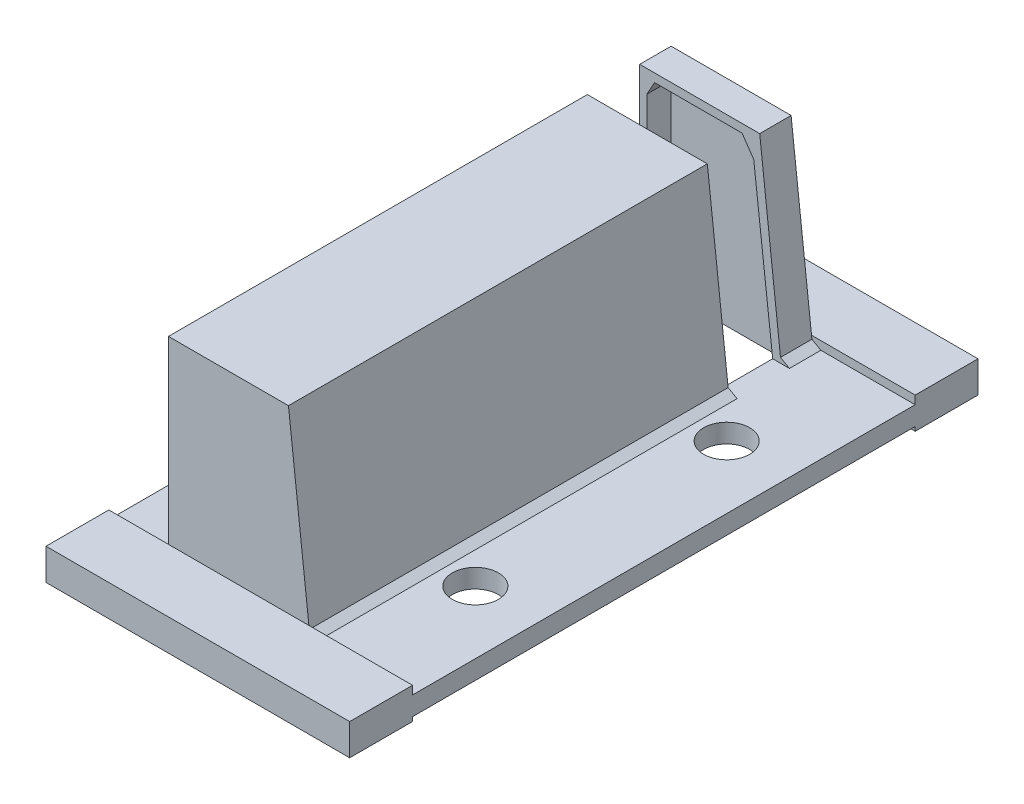
from build123d import *

# Parameters (mm, degrees)
BOSS_EXTRUDE2_DEPTH   = 3.81
BOSS_EXTRUDE2_2_DEPTH = 3.81
BOSS_EXTRUDE3_START   = 0.508
SKETCH2_3_R           = 2.794
BOSS_EXTRUDE3_DEPTH   = 2.286
BOSS_EXTRUDE11_DEPTH  = 3.81
BOSS_EXTRUDE12_DEPTH  = 0.889
BOSS_EXTRUDE14_START  = 10.16
BOSS_EXTRUDE14_DEPTH  = 50.8
BOSS_EXTRUDE17_START  = 60.071
BOSS_EXTRUDE17_DEPTH  = 0.889
SKETCH14_W            = 15.24
SKETCH14_H            = 59.182
CUT_EXTRUDE3_DEPTH    = 88.666803866


with BuildPart() as part:
    # Sketch2 → Boss-Extrude2 (new body)
    with BuildSketch(Plane(origin=(0, 0, 0), x_dir=(1, 0, 0), z_dir=(0, 1, 0))):
        Polygon((0, 7.62), (0, 0), (36.83, 0), (36.83, 7.62), (7.62, 7.62), (6.87, 7.62), align=None)
    extrude(amount=BOSS_EXTRUDE2_DEPTH)



with BuildPart() as body_2:
    # Sketch2 → Boss-Extrude2 2 (new body)
    with BuildSketch(Plane(origin=(0, 0, 0), x_dir=(1, 0, 0), z_dir=(0, 1, 0))):
        Polygon((0, 76.2), (0, 68.58), (6.87, 68.58), (7.62, 68.58), (36.83, 68.58), (36.83, 76.2), align=None)
    extrude(amount=BOSS_EXTRUDE2_2_DEPTH)


with BuildPart() as part_1:
    add(part.part)

    add(body_2.part)  # Boss-Extrude3 merges body 2
    # Sketch2<3> → Boss-Extrude3 (add)
    # profile 1 of 2: a face of its own
    with BuildSketch(Plane(origin=(0, 0, 0), x_dir=(1, 0, 0), z_dir=(0, 1, 0)).offset(BOSS_EXTRUDE3_START)):
        Polygon((0, 68.58), (0, 7.62), (6.87, 7.62), (7.62, 7.62), (36.83, 7.62), (36.83, 68.58), (7.62, 68.58), (6.87, 68.58), align=None)
        with Locations(Location((29.21, 22.86, 0), (0, 0, 270))):
            Circle(SKETCH2_3_R, mode=Mode.SUBTRACT)
        with Locations(Location((29.21, 53.34, 0), (0, 0, 270))):
            Circle(SKETCH2_3_R, mode=Mode.SUBTRACT)
    # profile 2 of 2: a face of its own
    with BuildSketch(Plane(origin=(0, 0, 0), x_dir=(1, 0, 0), z_dir=(0, 1, 0)).offset(BOSS_EXTRUDE3_START)):
        Polygon((0, 68.58), (0, 7.62), (6.87, 7.62), (7.62, 7.62), (36.83, 7.62), (36.83, 68.58), (7.62, 68.58), (6.87, 68.58), align=None)
        with Locations(Location((29.21, 22.86, 0), (0, 0, 270))):
            Circle(SKETCH2_3_R, mode=Mode.SUBTRACT)
        with Locations(Location((29.21, 53.34, 0), (0, 0, 270))):
            Circle(SKETCH2_3_R, mode=Mode.SUBTRACT)
    extrude(amount=BOSS_EXTRUDE3_DEPTH)

    # Sketch13 → Boss-Extrude11 (add)
    with BuildSketch(Plane.XY.offset(-68.58)):
        Polygon((6.215980089, 2.794), (7.231980089, 2.794), (7.231980089, 3.298518966), align=None)
        Polygon((8.120980089, 2.794), (8.120980089, 3.81), (7.231980089, 3.81), (7.231980089, 3.298518966), (7.231980089, 2.794), align=None)
        Polygon((8.120980089, 3.81), (8.120980089, 22.975432281), (8.120980089, 24.638), (9.046534916, 24.638), (19.649280137, 24.638), (20.820980089, 24.638), (21.060045846, 22.582034491), (23.242840554, 3.81), (24.261745737, 3.81), (21.784207173, 25.654), (7.231980089, 25.654), (7.231980089, 3.81), align=None)
        Polygon((8.120980089, 24.638), (8.120980089, 22.975432281), (9.046534916, 24.638), align=None)
        Polygon((20.820980089, 24.638), (19.649280137, 24.638), (21.060045846, 22.582034491), align=None)
        Polygon((24.261745737, 3.81), (23.242840554, 3.81), (23.360980089, 2.794), (24.376980089, 2.794), (24.307041878, 3.410632288), align=None)
        Polygon((24.307041878, 3.410632288), (24.376980089, 2.794), (25.392980089, 2.794), align=None)
    extrude(amount=BOSS_EXTRUDE11_DEPTH)

    # Sketch13<3> → Boss-Extrude12 (add)
    with BuildSketch(Plane.XY.offset(-68.58)):
        Polygon((9.046534916, 24.638), (8.120980089, 22.975432281), (8.120980089, 3.81), (23.242840554, 3.81), (21.060045846, 22.582034491), (19.649280137, 24.638), align=None)
        Polygon((23.242840554, 3.81), (8.120980089, 3.81), (8.120980089, 2.794), (23.360980089, 2.794), align=None)
    extrude(amount=BOSS_EXTRUDE12_DEPTH)

    # Sketch13<6> → Boss-Extrude14 (add)
    with BuildSketch(Plane.XY.offset(-68.58).offset(BOSS_EXTRUDE14_START)):
        Polygon((24.307041878, 3.410632288), (24.376980089, 2.794), (25.392980089, 2.794), align=None)
        Polygon((24.261745737, 3.81), (23.242840554, 3.81), (23.360980089, 2.794), (24.376980089, 2.794), (24.307041878, 3.410632288), align=None)
        Polygon((8.120980089, 2.794), (8.120980089, 3.81), (7.231980089, 3.81), (7.231980089, 3.298518966), (7.231980089, 2.794), align=None)
        Polygon((6.215980089, 2.794), (7.231980089, 2.794), (7.231980089, 3.298518966), align=None)
        Polygon((8.120980089, 3.81), (8.120980089, 22.975432281), (8.120980089, 24.638), (9.046534916, 24.638), (19.649280137, 24.638), (20.820980089, 24.638), (21.060045846, 22.582034491), (23.242840554, 3.81), (24.261745737, 3.81), (21.784207173, 25.654), (7.231980089, 25.654), (7.231980089, 3.81), align=None)
        Polygon((20.820980089, 24.638), (19.649280137, 24.638), (21.060045846, 22.582034491), align=None)
        Polygon((8.120980089, 24.638), (8.120980089, 22.975432281), (9.046534916, 24.638), align=None)
    extrude(amount=BOSS_EXTRUDE14_DEPTH)

    # Sketch13<7> → Boss-Extrude17 (add)
    with BuildSketch(Plane.XY.offset(-68.58).offset(BOSS_EXTRUDE17_START)):
        Polygon((9.046534916, 24.638), (8.120980089, 22.975432281), (8.120980089, 3.81), (23.242840554, 3.81), (21.060045846, 22.582034491), (19.649280137, 24.638), align=None)
        Polygon((23.242840554, 3.81), (8.120980089, 3.81), (8.120980089, 2.794), (23.360980089, 2.794), align=None)
    extrude(amount=BOSS_EXTRUDE17_DEPTH)

    # Sketch14 → Cut-Extrude3 (cut, through all)
    with BuildSketch(Plane(origin=(0, 2.794, 0), x_dir=(1, 0, 0), z_dir=(0, 1, 0))):
        with Locations((15.740980089, 38.1)):
            Rectangle(SKETCH14_W, SKETCH14_H)
    extrude(amount=-CUT_EXTRUDE3_DEPTH, mode=Mode.SUBTRACT)


solid = part_1.part
